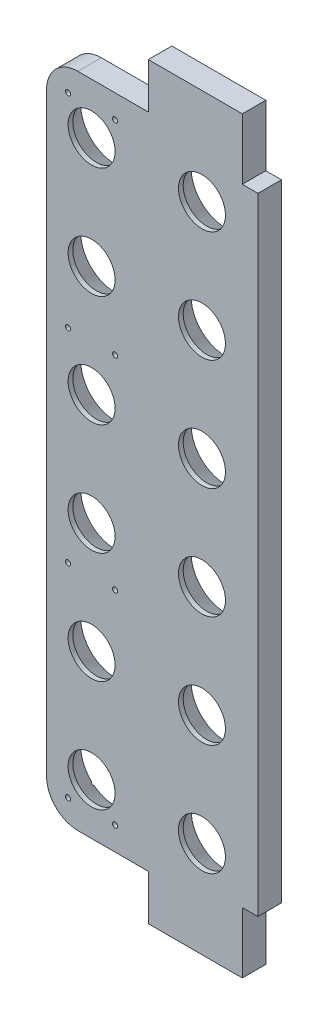
from build123d import *
from OCP.BRepFilletAPI import BRepFilletAPI_MakeChamfer

# Parameters (mm, degrees)
ESQUISSE1_W                  = 125
ESQUISSE1_H                  = 420
BOSS_EXTRU_1_DEPTH           = 15
ENL_V_MAT_EXTRU_1_DEPTH      = 439.463225368
ENL_V_MAT_EXTRU_1_DEPTH_BACK = 439.463225368
ESQUISSE2_R                  = 15
CHANFREIN1_SIZE              = 12
CHANFREIN1_SIZE2             = 6.92820323
ESQUISSE3_W                  = 60
ESQUISSE3_H                  = 29
BOSS_EXTRU_2_DEPTH           = 15
CONG_1_R                     = 20
ENL_V_MAT_EXTRU_2_DEPTH      = 467.316416181
ENL_V_MAT_EXTRU_2_DEPTH_BACK = 467.316416181
ESQUISSE4_R                  = 1.65
ESQUISSE5_W                  = 10
ESQUISSE5_H                  = 400
BOSS_EXTRU_3_DEPTH           = 15


with BuildPart() as part:
    # Esquisse1 → Boss.-Extru.1 (new body)
    with BuildSketch(Plane.XY):
        with Locations((62.5, 210)):
            Rectangle(ESQUISSE1_W, ESQUISSE1_H)
    extrude(amount=BOSS_EXTRU_1_DEPTH)

    # Esquisse2 → Enlèv. mat.-Extru.1 (cut, two sides: drawn at the far end of the back side and taken through both)
    with BuildSketch(Plane.XY.offset(15).offset(-ENL_V_MAT_EXTRU_1_DEPTH_BACK)):
        with Locations((28.75, 245.5)):
            Circle(ESQUISSE2_R)
        with Locations(Location((99.25, 245.5, 0), (0, 0, 180))):
            Circle(ESQUISSE2_R)
        with Locations((99.25, 174.5)):
            Circle(ESQUISSE2_R)
        with Locations(Location((28.75, 174.5, 0), (0, 0, 180))):
            Circle(ESQUISSE2_R)
        with Locations((28.75, 103.5)):
            Circle(ESQUISSE2_R)
        with Locations(Location((99.25, 103.5, 0), (0, 0, 180))):
            Circle(ESQUISSE2_R)
        with Locations((99.25, 32.5)):
            Circle(ESQUISSE2_R)
        with Locations(Location((28.75, 32.5, 0), (0, 0, 180))):
            Circle(ESQUISSE2_R)
        with Locations((28.75, 387.5)):
            Circle(ESQUISSE2_R)
        with Locations(Location((99.25, 387.5, 0), (0, 0, 180))):
            Circle(ESQUISSE2_R)
        with Locations((99.25, 316.5)):
            Circle(ESQUISSE2_R)
        with Locations(Location((28.75, 316.5, 0), (0, 0, 180))):
            Circle(ESQUISSE2_R)
    extrude(amount=ENL_V_MAT_EXTRU_1_DEPTH + ENL_V_MAT_EXTRU_1_DEPTH_BACK, mode=Mode.SUBTRACT)

    # Chanfrein1: one chamfer whose edges measure the first distance from different faces: ONE call of the kernel's chamfer builder (chamfer() names one face for all edges)
    chanfrein1_edges_1 = [part.edges().sort_by_distance(p)[0] for p in [
        (13.75, 245.5, 0),
    ]]
    chanfrein1_side_1 = [part.faces().sort_by_distance(p)[0] for p in [
        (13.75, 245.5, 7.5),
    ]]
    chanfrein1_edges_2 = [part.edges().sort_by_distance(p)[0] for p in [
        (84.25, 32.5, 0),
    ]]
    chanfrein1_side_2 = [part.faces().sort_by_distance(p)[0] for p in [
        (84.25, 32.5, 7.5),
    ]]
    chanfrein1_edges_3 = [part.edges().sort_by_distance(p)[0] for p in [
        (43.75, 32.5, 0),
    ]]
    chanfrein1_side_3 = [part.faces().sort_by_distance(p)[0] for p in [
        (43.75, 32.5, 7.5),
    ]]
    chanfrein1_edges_4 = [part.edges().sort_by_distance(p)[0] for p in [
        (13.75, 387.5, 0),
    ]]
    chanfrein1_side_4 = [part.faces().sort_by_distance(p)[0] for p in [
        (13.75, 387.5, 7.5),
    ]]
    chanfrein1_edges_5 = [part.edges().sort_by_distance(p)[0] for p in [
        (114.25, 387.5, 0),
    ]]
    chanfrein1_side_5 = [part.faces().sort_by_distance(p)[0] for p in [
        (114.25, 387.5, 7.5),
    ]]
    chanfrein1_edges_6 = [part.edges().sort_by_distance(p)[0] for p in [
        (84.25, 316.5, 0),
    ]]
    chanfrein1_side_6 = [part.faces().sort_by_distance(p)[0] for p in [
        (84.25, 316.5, 7.5),
    ]]
    chanfrein1_edges_7 = [part.edges().sort_by_distance(p)[0] for p in [
        (43.75, 316.5, 0),
    ]]
    chanfrein1_side_7 = [part.faces().sort_by_distance(p)[0] for p in [
        (43.75, 316.5, 7.5),
    ]]
    chanfrein1_edges_8 = [part.edges().sort_by_distance(p)[0] for p in [
        (114.25, 245.5, 0),
    ]]
    chanfrein1_side_8 = [part.faces().sort_by_distance(p)[0] for p in [
        (114.25, 245.5, 7.5),
    ]]
    chanfrein1_edges_9 = [part.edges().sort_by_distance(p)[0] for p in [
        (84.25, 174.5, 0),
    ]]
    chanfrein1_side_9 = [part.faces().sort_by_distance(p)[0] for p in [
        (84.25, 174.5, 7.5),
    ]]
    chanfrein1_edges_10 = [part.edges().sort_by_distance(p)[0] for p in [
        (43.75, 174.5, 0),
    ]]
    chanfrein1_side_10 = [part.faces().sort_by_distance(p)[0] for p in [
        (43.75, 174.5, 7.5),
    ]]
    chanfrein1_edges_11 = [part.edges().sort_by_distance(p)[0] for p in [
        (13.75, 103.5, 0),
    ]]
    chanfrein1_side_11 = [part.faces().sort_by_distance(p)[0] for p in [
        (13.75, 103.5, 7.5),
    ]]
    chanfrein1_edges_12 = [part.edges().sort_by_distance(p)[0] for p in [
        (114.25, 103.5, 0),
    ]]
    chanfrein1_side_12 = [part.faces().sort_by_distance(p)[0] for p in [
        (114.25, 103.5, 7.5),
    ]]
    chanfrein1 = BRepFilletAPI_MakeChamfer(part.part.solid().wrapped)
    for e in chanfrein1_edges_1:
        chanfrein1.Add(CHANFREIN1_SIZE, CHANFREIN1_SIZE2, e.wrapped, chanfrein1_side_1[0].wrapped)  # the first distance lies on this face
    for e in chanfrein1_edges_2:
        chanfrein1.Add(CHANFREIN1_SIZE, CHANFREIN1_SIZE2, e.wrapped, chanfrein1_side_2[0].wrapped)  # the first distance lies on this face
    for e in chanfrein1_edges_3:
        chanfrein1.Add(CHANFREIN1_SIZE, CHANFREIN1_SIZE2, e.wrapped, chanfrein1_side_3[0].wrapped)  # the first distance lies on this face
    for e in chanfrein1_edges_4:
        chanfrein1.Add(CHANFREIN1_SIZE, CHANFREIN1_SIZE2, e.wrapped, chanfrein1_side_4[0].wrapped)  # the first distance lies on this face
    for e in chanfrein1_edges_5:
        chanfrein1.Add(CHANFREIN1_SIZE, CHANFREIN1_SIZE2, e.wrapped, chanfrein1_side_5[0].wrapped)  # the first distance lies on this face
    for e in chanfrein1_edges_6:
        chanfrein1.Add(CHANFREIN1_SIZE, CHANFREIN1_SIZE2, e.wrapped, chanfrein1_side_6[0].wrapped)  # the first distance lies on this face
    for e in chanfrein1_edges_7:
        chanfrein1.Add(CHANFREIN1_SIZE, CHANFREIN1_SIZE2, e.wrapped, chanfrein1_side_7[0].wrapped)  # the first distance lies on this face
    for e in chanfrein1_edges_8:
        chanfrein1.Add(CHANFREIN1_SIZE, CHANFREIN1_SIZE2, e.wrapped, chanfrein1_side_8[0].wrapped)  # the first distance lies on this face
    for e in chanfrein1_edges_9:
        chanfrein1.Add(CHANFREIN1_SIZE, CHANFREIN1_SIZE2, e.wrapped, chanfrein1_side_9[0].wrapped)  # the first distance lies on this face
    for e in chanfrein1_edges_10:
        chanfrein1.Add(CHANFREIN1_SIZE, CHANFREIN1_SIZE2, e.wrapped, chanfrein1_side_10[0].wrapped)  # the first distance lies on this face
    for e in chanfrein1_edges_11:
        chanfrein1.Add(CHANFREIN1_SIZE, CHANFREIN1_SIZE2, e.wrapped, chanfrein1_side_11[0].wrapped)  # the first distance lies on this face
    for e in chanfrein1_edges_12:
        chanfrein1.Add(CHANFREIN1_SIZE, CHANFREIN1_SIZE2, e.wrapped, chanfrein1_side_12[0].wrapped)  # the first distance lies on this face
    add(Compound.cast(chanfrein1.Shape()), mode=Mode.REPLACE)

    # Esquisse3 → Boss.-Extru.2 (add)
    with BuildSketch(Plane.XY.offset(15)):
        with Locations((95, 434.5)):
            Rectangle(ESQUISSE3_W, ESQUISSE3_H)
        with Locations((95, -14.5)):
            Rectangle(ESQUISSE3_W, ESQUISSE3_H)
    extrude(amount=-BOSS_EXTRU_2_DEPTH)

    # Congé1
    cong_1_edges = [part.edges().sort_by_distance(p)[0] for p in [
        (0, 420, 7.5),
        (0, 0, 7.5),
    ]]
    fillet(cong_1_edges, radius=CONG_1_R)

    # Esquisse4 → Enlèv. mat.-Extru.2 (cut, two sides: drawn at the far end of the back side and taken through both)
    with BuildSketch(Plane.XY.offset(15).offset(-ENL_V_MAT_EXTRU_2_DEPTH_BACK)):
        with Locations(Location((13.75, 405, 0), (0, 0, 356.297009275))):
            Circle(ESQUISSE4_R)
        with Locations((13.75, 275)):
            Circle(ESQUISSE4_R)
        with Locations(Location((43.75, 275, 0), (0, 0, 180))):
            Circle(ESQUISSE4_R)
        with Locations(Location((43.75, 405, 0), (0, 0, 275.094419985))):
            Circle(ESQUISSE4_R)
        with Locations(Location((43.75, 15, 0), (0, 0, 84.905577747))):
            Circle(ESQUISSE4_R)
        with Locations((43.75, 145)):
            Circle(ESQUISSE4_R)
        with Locations(Location((13.75, 145, 0), (0, 0, 180))):
            Circle(ESQUISSE4_R)
        with Locations(Location((13.75, 15, 0), (0, 0, 3.702988457))):
            Circle(ESQUISSE4_R)
    extrude(amount=ENL_V_MAT_EXTRU_2_DEPTH + ENL_V_MAT_EXTRU_2_DEPTH_BACK, mode=Mode.SUBTRACT)

    # Esquisse5 → Boss.-Extru.3 (add)
    with BuildSketch(Plane.XY.offset(15)):
        with Locations((130, 210)):
            Rectangle(ESQUISSE5_W, ESQUISSE5_H)
    extrude(amount=-BOSS_EXTRU_3_DEPTH)


solid = part.part
